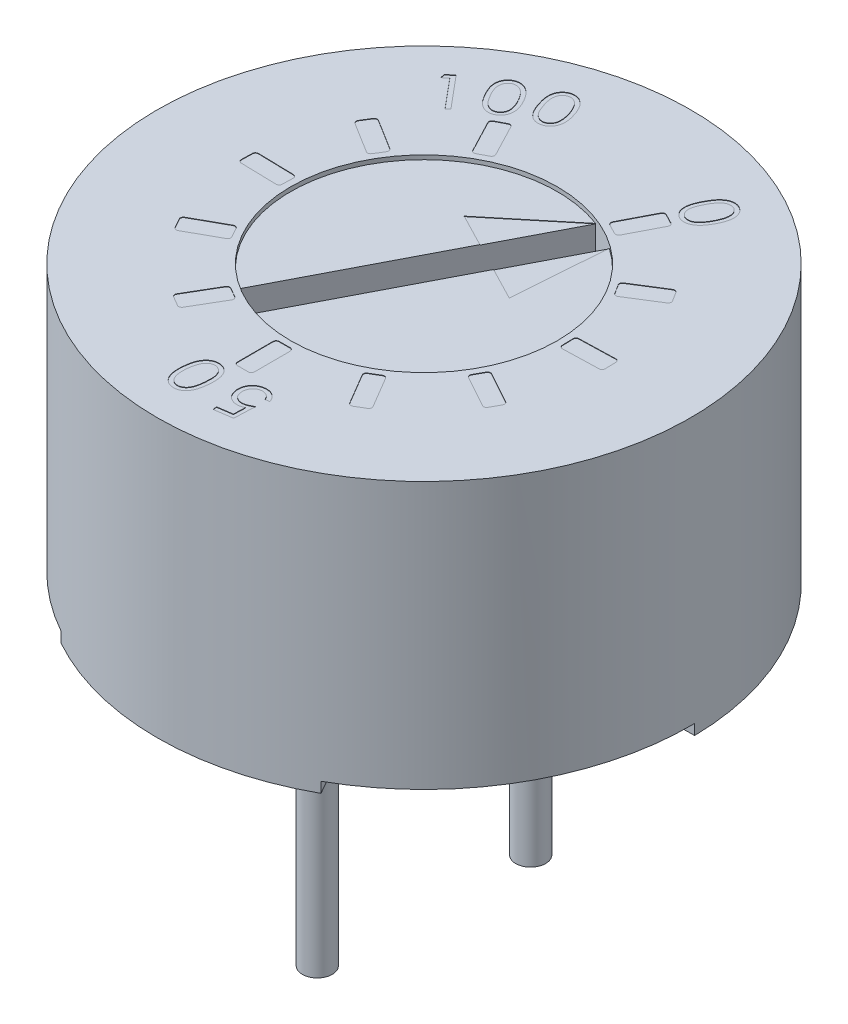
from build123d import *

# Parameters (mm, degrees)
SKETCH1_R                = 6.35
EXTRUDE1_DEPTH           = 6.35
SKETCH2_R                = 3.175
EXTRUDE2_DEPTH           = 0.1
EXTRUDE3_DEPTH           = 0.9
EXTRUDE4_DEPTH           = 0.01
EXTRUDE5_DEPTH           = 0.01
FILLET1_R                = 0.075
CIRPATTERN1_COUNT        = 11
CIRPATTERN1_ANGLE        = 305
FILLET1_OF_CIRPATTERN1_R = 0.075
EXTRUDE6_DEPTH           = 0.01
EXTRUDE7_START           = 0.25
EXTRUDE7_DEPTH           = 0.25
CIRPATTERN2_COUNT        = 3
SKETCH8_R                = 0.3555
EXTRUDE8_DEPTH           = 4.57
SKETCH9_R                = 0.3555
EXTRUDE9_DEPTH           = 2.285


with BuildPart() as part:
    # Sketch1 → Extrude1 (new body)
    with BuildSketch(Plane(origin=(0, 0, 0), x_dir=(1, 0, 0), z_dir=(0, 1, 0))):
        with Locations(Location((0, 0, 0), (0, 0, 270))):
            Circle(SKETCH1_R)
    extrude(amount=EXTRUDE1_DEPTH)

    # Sketch2 → Extrude2 (cut)
    with BuildSketch(Plane(origin=(0, 6.35, 0), x_dir=(-1, 0, 0), z_dir=(0, 1, 0))):
        with Locations(Location((0, 0, 0), (0, 0, 90))):
            Circle(SKETCH2_R)
    extrude(amount=-EXTRUDE2_DEPTH, mode=Mode.SUBTRACT)

    # Sketch3 → Extrude3 (cut)
    with BuildSketch(Plane(origin=(0, 6.25, 0), x_dir=(-1, 0, 0), z_dir=(0, 1, 0))):
        with BuildLine():
            Line((-1.110998183, -2.974274372), (1.787669102, 2.623902472))
            Line((1.787669102, 2.623902472), (-1.787669102, -2.623902472))
            ThreePointArc((-1.787669102, -2.623902472), (-1.459882914, -2.819462161), (-1.110998183, -2.974274372))
        make_face()
        Polygon((1.787669102, 2.623902472), (-1.787669102, -2.623902472), (1.110998183, 2.974274372), align=None)
    extrude(amount=-EXTRUDE3_DEPTH, mode=Mode.SUBTRACT)

    # Sketch4 → Extrude4 (cut)
    with BuildSketch(Plane(origin=(0, 6.25, 0), x_dir=(-1, 0, 0), z_dir=(0, 1, 0))):
        Polygon((-1.110998183, -2.974274372), (0.603770905, -1.560069871), (-1.622475198, -0.407346954), (-1.787669102, -2.623902472), align=None)
    extrude(amount=-EXTRUDE4_DEPTH, mode=Mode.SUBTRACT)

    # Sketch5 → Extrude5 (cut)
    with BuildSketch(Plane(origin=(0, 6.35, 0), x_dir=(-1, 0, 0), z_dir=(0, 1, 0))):
        Polygon((-1.708707163, -2.858570345), (-1.348209149, -3.045231794), (-1.806658783, -3.930632521), (-2.167156797, -3.743971073), align=None)
    extrude5 = extrude(amount=-EXTRUDE5_DEPTH, mode=Mode.SUBTRACT)

    # Fillet1
    fillet1_edges = [part.edges().sort_by_distance(p)[0] for p in [
        (2.167156797, 6.345, -3.743971073),
        (1.708707163, 6.345, -2.858570345),
        (1.348209149, 6.345, -3.045231794),
        (1.806658783, 6.345, -3.930632521),
    ]]
    fillet(fillet1_edges, radius=FILLET1_R)

    # CirPattern1: Extrude5 ×11 about axis
    cirpattern1_axis = Axis((0, 0, 0), (0, -1, 0))
    for i in range(1, CIRPATTERN1_COUNT):
        add(extrude5.rotate(cirpattern1_axis, i * CIRPATTERN1_ANGLE / (CIRPATTERN1_COUNT - 1)), mode=Mode.SUBTRACT)

    # Fillet1 of CirPattern1
    fillet1_of_cirpattern1_edges = [part.edges().sort_by_distance(p)[0] for p in [
        (3.767494441, 6.345, -2.125999439),
        (2.923106032, 6.345, -1.59579313),
        (2.707228277, 6.345, -1.939592649),
        (3.551616686, 6.345, -2.469798958),
        (4.325209347, 6.345, 0.080324849),
        (3.328559629, 6.345, 0.108606555),
        (3.317044506, 6.345, -0.297187378),
        (4.313694223, 6.345, -0.325469085),
        (3.685958556, 6.345, 2.264419904),
        (2.812862046, 6.345, 1.78295028),
        (3.008896268, 6.345, 1.427462027),
        (3.881992778, 6.345, 1.90893165),
        (2.026649405, 6.345, 3.821855592),
        (1.518728296, 6.345, 2.963877351),
        (1.868061025, 6.345, 2.757073194),
        (2.375982134, 6.345, 3.615051435),
        (-0.193518105, 6.345, 4.321624546),
        (-0.195700872, 6.345, 3.324576027),
        (0.210255437, 6.345, 3.323687296),
        (0.212438204, 6.345, 4.320735815),
        (-2.36013109, 6.345, 3.625419867),
        (-1.855971452, 6.345, 2.765225951),
        (-1.505736593, 6.345, 2.970498595),
        (-2.009896231, 6.345, 3.830692511),
        (-3.873597434, 6.345, 1.925910407),
        (-3.002617376, 6.345, 1.440622602),
        (-2.805028551, 6.345, 1.795249124),
        (-3.676008609, 6.345, 2.280536929),
        (-4.31507792, 6.345, -0.306578734),
        (-3.318313926, 6.345, -0.282661065),
        (-3.328052197, 6.345, 0.123179397),
        (-4.324816191, 6.345, 0.099261728),
        (-3.562396497, 6.345, -2.454224761),
        (-2.715694708, 6.345, -1.927720634),
        (-2.93006509, 6.345, -1.582979203),
        (-3.776766879, 6.345, -2.10948333),
        (-1.823851485, 6.345, -3.922684506),
        (-1.361529577, 6.345, -3.039299558),
        (-1.72120685, 6.345, -2.851061481),
        (-2.183528759, 6.345, -3.73444643),
    ]]
    fillet(fillet1_of_cirpattern1_edges, radius=FILLET1_OF_CIRPATTERN1_R)

    # Sketch6 → Extrude6 (cut)
    # profile 1 of 6: a face of its own
    with BuildSketch(Plane(origin=(0, 6.35, 0), x_dir=(-1, 0, 0), z_dir=(0, 1, 0))):
        with BuildLine():
            add(Edge.make_bspline(
                [(-2.041021286, -4.610610271), (-2.048531853, -4.624755576), (-2.06311616, -4.652223472), (-2.086001625, -4.69125374), (-2.108657118, -4.727192412), (-2.131039382, -4.760168413), (-2.153479558, -4.790014029), (-2.175641804, -4.816907029), (-2.197641805, -4.840743116), (-2.219926861, -4.861280257), (-2.242088562, -4.879450124), (-2.264352286, -4.895530271), (-2.286815404, -4.909630335), (-2.309553916, -4.921649597), (-2.332438091, -4.932009201), (-2.355643815, -4.940184801), (-2.37903135, -4.946407854), (-2.402453925, -4.950891388), (-2.425848928, -4.953225285), (-2.449018334, -4.953868168), (-2.471927638, -4.952656985), (-2.494570744, -4.949660305), (-2.516884525, -4.944846403), (-2.538830956, -4.938150873), (-2.560563701, -4.929780401), (-2.574592533, -4.922822508), (-2.58168635, -4.919304181)],
                knots=[0, 0, 0, 0, 1.646223793, 3.196700494, 4.649742713, 6.012941573, 7.292431642, 8.486824456, 9.594156292, 10.623879785, 11.599467776, 12.538661719, 13.445257722, 14.323474714, 15.180732222, 16.025253637, 16.849445287, 17.666632674, 18.473958694, 19.263611761, 20.047215134, 20.829675219, 21.609209308, 22.390946454, 23.186366309, 24, 24, 24, 24], degree=3))
            add(Edge.make_bspline(
                [(-2.58168635, -4.919304181), (-2.588698657, -4.915408805), (-2.60256311, -4.907707023), (-2.622019753, -4.894301888), (-2.640388582, -4.879957881), (-2.657183356, -4.863983072), (-2.672939529, -4.846976876), (-2.687141375, -4.82848917), (-2.699956741, -4.808740477), (-2.711662464, -4.787950538), (-2.72166197, -4.765817723), (-2.730090491, -4.742595521), (-2.736712959, -4.71827246), (-2.741439118, -4.69293817), (-2.744723976, -4.666583463), (-2.745998033, -4.63913782), (-2.745837145, -4.610577879), (-2.743802285, -4.580871354), (-2.739794255, -4.549807126), (-2.733341215, -4.517426145), (-2.724396537, -4.483616682), (-2.713158937, -4.448385973), (-2.699438003, -4.411654951), (-2.68339151, -4.373534508), (-2.665157067, -4.333841783), (-2.651441797, -4.307337174), (-2.64438667, -4.29370322)],
                knots=[0, 0, 0, 0, 0.818221664, 1.617755219, 2.408528098, 3.194352339, 3.980531087, 4.772477655, 5.570121229, 6.381617826, 7.205044658, 8.045773436, 8.900471949, 9.774565544, 10.673929054, 11.608764819, 12.576480326, 13.587359863, 14.645641413, 15.770959321, 16.954448403, 18.213090284, 19.543499224, 20.954674762, 22.433486647, 24, 24, 24, 24], degree=3))
            add(Edge.make_bspline(
                [(-2.64438667, -4.29370322), (-2.637124457, -4.280235866), (-2.622985978, -4.254016874), (-2.60095621, -4.216478699), (-2.578709163, -4.181839203), (-2.55653027, -4.149856158), (-2.534024093, -4.120741021), (-2.511531366, -4.094298686), (-2.488770271, -4.070693893), (-2.465867329, -4.049774907), (-2.442775149, -4.031241871), (-2.419420323, -4.015058885), (-2.396184811, -4.000507155), (-2.37274737, -3.987980142), (-2.348950012, -3.977830401), (-2.325199321, -3.969264113), (-2.301156487, -3.96313217), (-2.277143053, -3.958623983), (-2.253147184, -3.956298298), (-2.229377832, -3.955650177), (-2.205940061, -3.956873389), (-2.182796835, -3.959790761), (-2.160146854, -3.964952482), (-2.137724394, -3.971512559), (-2.115680074, -3.980117646), (-2.101466108, -3.987234067), (-2.094306542, -3.990818604)],
                knots=[0, 0, 0, 0, 1.563066569, 3.04306472, 4.445255294, 5.768070441, 7.017934814, 8.203285405, 9.312900082, 10.365568574, 11.37021548, 12.335361849, 13.266719831, 14.169998601, 15.046927578, 15.907789319, 16.746666351, 17.578915802, 18.401604668, 19.20682736, 20.006017033, 20.79715974, 21.586653741, 22.376619151, 23.182304051, 24, 24, 24, 24], degree=3))
            add(Edge.make_bspline(
                [(-2.094306542, -3.990818604), (-2.087446495, -3.994675057), (-2.07386944, -4.002307551), (-2.054523793, -4.015120822), (-2.036605205, -4.029448122), (-2.0200715, -4.045060049), (-2.004642191, -4.061739076), (-1.990885304, -4.079897626), (-1.978190192, -4.099111424), (-1.966987579, -4.119633891), (-1.957126968, -4.141202932), (-1.949118822, -4.163872166), (-1.942987176, -4.187560426), (-1.938006109, -4.212136724), (-1.935403728, -4.23788995), (-1.934103102, -4.264579002), (-1.934858942, -4.292271187), (-1.936944656, -4.321127664), (-1.941436345, -4.351318054), (-1.948385685, -4.383131205), (-1.95760235, -4.416701738), (-1.969350861, -4.452115777), (-1.98351963, -4.489309402), (-2.000624185, -4.528154188), (-2.019425161, -4.56908205), (-2.033690198, -4.596512972), (-2.041021286, -4.610610271)],
                knots=[0, 0, 0, 0, 0.80975725, 1.602630119, 2.385010428, 3.167722644, 3.94108762, 4.720413811, 5.509495508, 6.309129477, 7.124118522, 7.947868044, 8.779633185, 9.640826942, 10.525686133, 11.440589076, 12.389146411, 13.374742675, 14.416567519, 15.527195189, 16.724182898, 17.997633339, 19.365778855, 20.818548637, 22.364988512, 24, 24, 24, 24], degree=3))
        make_face()
        with BuildLine():
            add(Edge.make_bspline(
                [(-2.123553337, -4.564937194), (-2.117286631, -4.552813491), (-2.105136617, -4.529307815), (-2.088424447, -4.494701656), (-2.074134035, -4.461784593), (-2.06124576, -4.430941485), (-2.050927746, -4.401733677), (-2.042427765, -4.374487635), (-2.035895032, -4.349101458), (-2.03139254, -4.325340978), (-2.028893185, -4.302766236), (-2.027281062, -4.281173433), (-2.027651059, -4.260228358), (-2.028844687, -4.2400545), (-2.031948814, -4.220639917), (-2.036379206, -4.202052612), (-2.041914985, -4.184018898), (-2.051504456, -4.161509841), (-2.0656894, -4.135578976), (-2.086635675, -4.108424876), (-2.110920005, -4.08564519), (-2.129795725, -4.074622839), (-2.139178337, -4.069143925)],
                knots=[0, 0, 0, 0, 1.476864034, 2.863373306, 4.157598534, 5.359904342, 6.479804183, 7.508323379, 8.447691968, 9.315042264, 10.122600593, 10.904636606, 11.656166216, 12.38773407, 13.089838447, 13.780395253, 14.454577122, 15.128255394, 16.425261349, 17.640804981, 18.827307688, 20, 20, 20, 20], degree=3))
            add(Edge.make_bspline(
                [(-2.139178337, -4.069143925), (-2.149122795, -4.064487819), (-2.168965944, -4.055197037), (-2.20138924, -4.048076524), (-2.23517109, -4.045724566), (-2.264081979, -4.048740277), (-2.28755093, -4.053663221), (-2.305243312, -4.059116747), (-2.322768458, -4.066212325), (-2.340190488, -4.074826702), (-2.357550656, -4.085118303), (-2.37463558, -4.097186603), (-2.391796648, -4.110575198), (-2.402666234, -4.120548689), (-2.408208786, -4.125634309)],
                knots=[0, 0, 0, 0, 1.339707884, 2.67325019, 4.032244688, 5.468513708, 6.211919267, 6.963848198, 7.729888153, 8.522640497, 9.339397821, 10.195992865, 11.080112023, 12, 12, 12, 12], degree=3))
            add(Edge.make_bspline(
                [(-2.408208786, -4.125634309), (-2.415086685, -4.132312362), (-2.429052247, -4.145872136), (-2.449102524, -4.167815229), (-2.468666444, -4.19147895), (-2.488034937, -4.21678888), (-2.506720234, -4.244034937), (-2.52521413, -4.272930727), (-2.543218117, -4.303556227), (-2.554644606, -4.324781822), (-2.560452376, -4.335570207)],
                knots=[0, 0, 0, 0, 0.883043492, 1.793018297, 2.736619076, 3.711077747, 4.728102424, 5.779306923, 6.871282927, 8, 8, 8, 8], degree=3))
            add(Edge.make_bspline(
                [(-2.560452376, -4.335570207), (-2.566058327, -4.346489454), (-2.577026056, -4.367852347), (-2.592004549, -4.3996451), (-2.605387637, -4.430385306), (-2.616696857, -4.460193006), (-2.626642473, -4.48895065), (-2.634854581, -4.51667578), (-2.641354722, -4.543406218), (-2.64596488, -4.569103944), (-2.648960094, -4.593723578), (-2.650589546, -4.617258451), (-2.650921494, -4.639748741), (-2.649384141, -4.661214079), (-2.646961792, -4.681674441), (-2.642737113, -4.701061821), (-2.636846682, -4.719295944), (-2.627688278, -4.741944743), (-2.613441929, -4.76762399), (-2.592570146, -4.794366758), (-2.568620721, -4.817120374), (-2.549942343, -4.828091642), (-2.540620645, -4.833567002)],
                knots=[0, 0, 0, 0, 1.328682253, 2.599492104, 3.803995452, 4.957191288, 6.049894639, 7.09748019, 8.086331245, 9.026421384, 9.922136576, 10.769867243, 11.579511995, 12.354634462, 13.097924459, 13.808287387, 14.49869283, 15.169871266, 16.451225399, 17.661527984, 18.832953831, 20, 20, 20, 20], degree=3))
            add(Edge.make_bspline(
                [(-2.540620645, -4.833567002), (-2.530681532, -4.838242489), (-2.510803491, -4.847593377), (-2.478117203, -4.85444344), (-2.444088294, -4.856532213), (-2.414922094, -4.853558891), (-2.391244581, -4.848655862), (-2.373312016, -4.843141276), (-2.355512606, -4.83621336), (-2.338022991, -4.827399056), (-2.320536693, -4.817450118), (-2.303294048, -4.805756201), (-2.286251167, -4.792487211), (-2.269207529, -4.777487501), (-2.2521011, -4.760278302), (-2.234540286, -4.740616716), (-2.217125893, -4.717794654), (-2.19883328, -4.692673024), (-2.180441614, -4.664661087), (-2.161586684, -4.634046056), (-2.14261665, -4.600462373), (-2.130051931, -4.577047561), (-2.123553337, -4.564937194)],
                knots=[0, 0, 0, 0, 1.184760376, 2.369498728, 3.58528124, 4.862625074, 5.5271166, 6.198988772, 6.889855373, 7.590919818, 8.315809253, 9.065159293, 9.842571992, 10.651274505, 11.519659924, 12.466336616, 13.500985966, 14.623780008, 15.827938908, 17.125147421, 18.513098482, 20, 20, 20, 20], degree=3))
        make_face(mode=Mode.SUBTRACT)
    # profile 2 of 6: a face of its own
    with BuildSketch(Plane(origin=(0, 6.35, 0), x_dir=(-1, 0, 0), z_dir=(0, 1, 0))):
        with BuildLine():
            add(Edge.make_bspline(
                [(0.074806635, 5.041278571), (0.076253019, 5.05717987), (0.079064937, 5.088093629), (0.084633258, 5.132937176), (0.091372288, 5.174918), (0.09948382, 5.21396143), (0.108101521, 5.250269229), (0.118077088, 5.283601117), (0.129317614, 5.313950167), (0.14155094, 5.341594669), (0.154963016, 5.366866043), (0.169165629, 5.390375032), (0.1843709, 5.412176974), (0.200401058, 5.432341191), (0.217467472, 5.450642734), (0.235593491, 5.467145218), (0.254654645, 5.481949447), (0.274471561, 5.495261932), (0.295101154, 5.50659638), (0.31622183, 5.516353106), (0.337867446, 5.524013051), (0.359807118, 5.530480037), (0.382256623, 5.534467097), (0.405056189, 5.537267404), (0.428321432, 5.537770959), (0.443934426, 5.536906782), (0.45180984, 5.536470879)],
                knots=[0, 0, 0, 0, 1.642272928, 3.19274716, 4.647094419, 6.014302073, 7.293671023, 8.484406887, 9.590545911, 10.620563334, 11.591427458, 12.531407715, 13.444066213, 14.323638965, 15.178902062, 16.01514516, 16.842227636, 17.659440999, 18.467978414, 19.26093357, 20.049593744, 20.827928056, 21.610583878, 22.391821981, 23.188812256, 24, 24, 24, 24], degree=3))
            add(Edge.make_bspline(
                [(0.45180984, 5.536470879), (0.459776416, 5.535676761), (0.475540474, 5.534105381), (0.498671768, 5.529300776), (0.521162664, 5.523214343), (0.542830451, 5.515118638), (0.563769121, 5.505439488), (0.584104069, 5.494198683), (0.603753383, 5.481165879), (0.622558566, 5.46633695), (0.640409469, 5.449837267), (0.657303149, 5.431880737), (0.672708275, 5.412031504), (0.687236981, 5.390772349), (0.70046777, 5.367649529), (0.712325386, 5.342779768), (0.723522642, 5.31648097), (0.733110975, 5.288285926), (0.741299997, 5.258109441), (0.74817994, 5.225834471), (0.753054419, 5.191288965), (0.756448315, 5.154520923), (0.758195109, 5.115416632), (0.758339236, 5.074054071), (0.756958285, 5.030419842), (0.754801258, 5.000674185), (0.753692853, 4.985389148)],
                knots=[0, 0, 0, 0, 0.81707043, 1.616798156, 2.409253754, 3.194606741, 3.97568502, 4.763196184, 5.565101387, 6.380890316, 7.20611523, 8.045613763, 8.895489273, 9.769293657, 10.673462277, 11.61281777, 12.581659369, 13.590887526, 14.651275446, 15.773366024, 16.958577418, 18.211847317, 19.542989128, 20.954561198, 22.435077587, 24, 24, 24, 24], degree=3))
            add(Edge.make_bspline(
                [(0.753692853, 4.985389148), (0.752352479, 4.970217417), (0.749737065, 4.940613478), (0.743762953, 4.897553333), (0.737078222, 4.856901215), (0.729183918, 4.818750765), (0.719631371, 4.783257182), (0.70940022, 4.750048531), (0.697522724, 4.71947348), (0.684755316, 4.691164552), (0.670480495, 4.665272037), (0.655853493, 4.640945776), (0.639854534, 4.61861904), (0.623156597, 4.597988176), (0.605355309, 4.579228939), (0.586754734, 4.562128645), (0.567088185, 4.546899089), (0.546629753, 4.533496482), (0.525606368, 4.52174807), (0.503898899, 4.512288429), (0.481958249, 4.504101612), (0.459582029, 4.497879196), (0.436702908, 4.493749458), (0.413555799, 4.49102985), (0.389896114, 4.490494934), (0.374081958, 4.49136085), (0.366072661, 4.491799404)],
                knots=[0, 0, 0, 0, 1.556680886, 3.037483888, 4.44238982, 5.767690181, 7.017696536, 8.198532969, 9.317813738, 10.368519616, 11.370309337, 12.338420547, 13.268362895, 14.175557506, 15.049479884, 15.90945687, 16.755946825, 17.588927135, 18.407691527, 19.214389107, 20.006899006, 20.800114037, 21.584617834, 22.381349166, 23.180212009, 24, 24, 24, 24], degree=3))
            add(Edge.make_bspline(
                [(0.366072661, 4.491799404), (0.358245114, 4.492622049), (0.342705022, 4.494255252), (0.319838037, 4.498660856), (0.297761534, 4.504923905), (0.276448081, 4.512727834), (0.255925315, 4.522246479), (0.235999715, 4.533199996), (0.216968652, 4.546182849), (0.198528364, 4.560520106), (0.181070801, 4.576564354), (0.164816696, 4.594272633), (0.149676323, 4.613588094), (0.136039358, 4.634621514), (0.123199228, 4.657004226), (0.111932423, 4.68114334), (0.101395117, 4.706738131), (0.092467186, 4.734223595), (0.084381141, 4.763686899), (0.07867704, 4.795761869), (0.073964428, 4.830302982), (0.071137523, 4.867490979), (0.069418669, 4.907247489), (0.06985741, 4.949678911), (0.071321145, 4.994646997), (0.073624235, 5.025459512), (0.074806635, 5.041278571)],
                knots=[0, 0, 0, 0, 0.810058639, 1.608215887, 2.393870619, 3.170328306, 3.942391259, 4.720945964, 5.50840321, 6.311518738, 7.124023985, 7.946242869, 8.78372413, 9.647457234, 10.524870221, 11.438149422, 12.387930972, 13.372719036, 14.41159343, 15.530687135, 16.723632428, 17.999595569, 19.368733634, 20.819277439, 22.367025888, 24, 24, 24, 24], degree=3))
        make_face()
        with BuildLine():
            add(Edge.make_bspline(
                [(0.168756956, 5.031462866), (0.167763766, 5.017844824), (0.165836978, 4.991425836), (0.163996956, 4.953022557), (0.163331317, 4.917146167), (0.16396735, 4.883809438), (0.165456164, 4.852926633), (0.168212696, 4.824506435), (0.172148773, 4.798537775), (0.177404973, 4.774941313), (0.183673322, 4.753119643), (0.191097995, 4.732830234), (0.199274621, 4.713639363), (0.208594034, 4.695748464), (0.218653752, 4.678839559), (0.23021874, 4.663470949), (0.242422294, 4.649104641), (0.259854834, 4.6320314), (0.2830943, 4.613762981), (0.313074127, 4.597185402), (0.344345582, 4.585536081), (0.366048005, 4.582739682), (0.376889969, 4.581342674)],
                knots=[0, 0, 0, 0, 1.477610655, 2.866563107, 4.160233266, 5.359977142, 6.474311365, 7.50540577, 8.448721511, 9.314810183, 10.119809356, 10.903876248, 11.651568986, 12.375523875, 13.085642101, 13.777924946, 14.454336735, 15.123725616, 16.416002462, 17.638660614, 18.820336478, 20, 20, 20, 20], degree=3))
            add(Edge.make_bspline(
                [(0.376889969, 4.581342674), (0.387791846, 4.580950833), (0.409623467, 4.580166149), (0.442217863, 4.586090859), (0.47392721, 4.597682202), (0.499415962, 4.611332085), (0.518955337, 4.625103785), (0.533269702, 4.636911122), (0.54665696, 4.650405298), (0.55924916, 4.665254074), (0.571177207, 4.681441149), (0.582402948, 4.699081548), (0.592762638, 4.71826648), (0.598921511, 4.731746441), (0.602050225, 4.738594276)],
                knots=[0, 0, 0, 0, 1.332950808, 2.669308781, 4.024721813, 5.455336601, 6.194947274, 6.949860932, 7.724708579, 8.519453021, 9.332334011, 10.18531817, 11.078139682, 12, 12, 12, 12], degree=3))
            add(Edge.make_bspline(
                [(0.602050225, 4.738594276), (0.605836058, 4.747363884), (0.613548763, 4.765229803), (0.623170212, 4.793351625), (0.632022963, 4.822813299), (0.639788524, 4.853703436), (0.646653835, 4.885958948), (0.652177689, 4.919731654), (0.656824541, 4.954937645), (0.659024006, 4.978969936), (0.660143174, 4.991198443)],
                knots=[0, 0, 0, 0, 0.880080856, 1.792948359, 2.737304663, 3.715004179, 4.727718167, 5.775921243, 6.868307628, 8, 8, 8, 8], degree=3))
            add(Edge.make_bspline(
                [(0.660143174, 4.991198443), (0.661115224, 5.00341207), (0.663015038, 5.027282881), (0.66405292, 5.062371152), (0.664374191, 5.095905408), (0.663397119, 5.127784012), (0.661204195, 5.158061356), (0.657837952, 5.186677663), (0.653270394, 5.213767553), (0.647453657, 5.239233018), (0.640625209, 5.263081608), (0.633035226, 5.28545199), (0.624484502, 5.30630366), (0.614824174, 5.325534582), (0.604469779, 5.343315813), (0.59292531, 5.35934769), (0.58078562, 5.374125295), (0.56328394, 5.391150882), (0.540232097, 5.409243548), (0.510622949, 5.425697766), (0.479717386, 5.43707713), (0.458307183, 5.439904891), (0.44760311, 5.441318635)],
                knots=[0, 0, 0, 0, 1.327787497, 2.595082083, 3.803754689, 4.962308897, 6.050838694, 7.093078982, 8.084210708, 9.027023232, 9.922741183, 10.771867947, 11.586360315, 12.363162899, 13.102940204, 13.813868132, 14.502375689, 15.172805586, 16.456934668, 17.665325549, 18.832774954, 20, 20, 20, 20], degree=3))
            add(Edge.make_bspline(
                [(0.44760311, 5.441318635), (0.436633538, 5.441715956), (0.414733414, 5.442509185), (0.381874679, 5.436509813), (0.34976645, 5.424846094), (0.323926992, 5.410800263), (0.304194615, 5.396748356), (0.289619858, 5.384962119), (0.276093227, 5.371533504), (0.263345829, 5.356649914), (0.25119201, 5.34059765), (0.23992626, 5.323024586), (0.229556542, 5.304090218), (0.219587798, 5.283721559), (0.210453476, 5.261198723), (0.202464941, 5.236155243), (0.194656873, 5.208628407), (0.18834509, 5.178238711), (0.181958039, 5.145372067), (0.176949393, 5.109709205), (0.172237359, 5.071523117), (0.169941179, 5.045093556), (0.168756956, 5.031462866)],
                knots=[0, 0, 0, 0, 1.185206334, 2.366196842, 3.586874517, 4.87075765, 5.534450156, 6.207170249, 6.89706176, 7.593920717, 8.326726547, 9.074454216, 9.850796106, 10.662074394, 11.527670968, 12.478381852, 13.505843225, 14.62285613, 15.836152336, 17.129034761, 18.519338396, 20, 20, 20, 20], degree=3))
        make_face(mode=Mode.SUBTRACT)
    # profile 3 of 6: a face of its own
    with BuildSketch(Plane(origin=(0, 6.35, 0), x_dir=(-1, 0, 0), z_dir=(0, 1, 0))):
        with BuildLine():
            Line((-0.49330418, 5.513245166), (-0.479882706, 5.419495166))
            Line((-0.479882706, 5.419495166), (-0.830844244, 5.369014397))
            Line((-0.830844244, 5.369014397), (-0.84086027, 5.093373371))
            add(Edge.make_bspline(
                [(-0.84086027, 5.093373371), (-0.830893577, 5.097703044), (-0.811510646, 5.106123265), (-0.782623499, 5.116299425), (-0.754909263, 5.123955185), (-0.73672349, 5.127100279), (-0.727879501, 5.128629781)],
                knots=[0, 0, 0, 0, 1.098060995, 2.135476651, 3.093256877, 4, 4, 4, 4], degree=3))
            add(Edge.make_bspline(
                [(-0.727879501, 5.128629781), (-0.716811521, 5.130001187), (-0.695130908, 5.132687578), (-0.662854407, 5.13263851), (-0.631695405, 5.130272426), (-0.601629593, 5.124335579), (-0.572625403, 5.115497056), (-0.544672409, 5.103647905), (-0.517860701, 5.088667697), (-0.492403551, 5.070909791), (-0.468534384, 5.050771719), (-0.447121151, 5.028283703), (-0.428099191, 5.003913382), (-0.411838663, 4.977454926), (-0.397969664, 4.949070392), (-0.386585806, 4.918758694), (-0.377588883, 4.886459147), (-0.373964382, 4.864050997), (-0.37211027, 4.852588114)],
                knots=[0, 0, 0, 0, 1.059390516, 2.075196892, 3.062695081, 4.026396627, 4.982329477, 5.940999043, 6.907269323, 7.897030198, 8.887950986, 9.871338629, 10.844094296, 11.821912505, 12.818511503, 13.843186958, 14.896682971, 16, 16, 16, 16], degree=3))
            add(Edge.make_bspline(
                [(-0.37211027, 4.852588114), (-0.371060211, 4.844586325), (-0.368974546, 4.828692874), (-0.367897681, 4.804788961), (-0.3680721, 4.78118302), (-0.369603772, 4.757882554), (-0.37289134, 4.734946409), (-0.377515498, 4.712274998), (-0.383439272, 4.689807825), (-0.391155204, 4.667870914), (-0.399807182, 4.646522078), (-0.409908185, 4.626202588), (-0.421117961, 4.60690361), (-0.433604593, 4.588709716), (-0.447005954, 4.571287461), (-0.46191513, 4.555185403), (-0.477683919, 4.5398193), (-0.494840307, 4.525879473), (-0.512771266, 4.512766515), (-0.531929316, 4.501164532), (-0.551957113, 4.490769983), (-0.572884388, 4.4815013), (-0.594769838, 4.473482418), (-0.61759945, 4.466743658), (-0.641305124, 4.460979203), (-0.657544731, 4.458442057), (-0.665780142, 4.457155422)],
                knots=[0, 0, 0, 0, 1.052462394, 2.09043992, 3.118426065, 4.131352733, 5.134189789, 6.138765847, 7.14884152, 8.162666836, 9.170523675, 10.152291099, 11.12047599, 12.079723174, 13.029429328, 13.985189194, 14.940154712, 15.899401896, 16.866528039, 17.836161928, 18.818045293, 19.808700456, 20.820165117, 21.856496307, 22.912988933, 24, 24, 24, 24], degree=3))
            add(Edge.make_bspline(
                [(-0.665780142, 4.457155422), (-0.675649176, 4.455986685), (-0.695007318, 4.453694204), (-0.723835673, 4.453157424), (-0.751780836, 4.454930352), (-0.778974326, 4.459073834), (-0.805308088, 4.465977044), (-0.830811408, 4.475180514), (-0.85545668, 4.486881712), (-0.878925706, 4.501085717), (-0.901088291, 4.5172653), (-0.921683318, 4.53514771), (-0.940262258, 4.554791438), (-0.957069009, 4.576009351), (-0.971914565, 4.598869533), (-0.984705092, 4.623473252), (-0.995851349, 4.649573683), (-1.001603047, 4.667837934), (-1.004522129, 4.677107345)],
                knots=[0, 0, 0, 0, 1.075548572, 2.109691868, 3.116791376, 4.104604437, 5.083139307, 6.059749083, 7.036439148, 8.032132384, 9.025644415, 10.00439295, 10.981216813, 11.948927236, 12.931593606, 13.927680527, 14.948263454, 16, 16, 16, 16], degree=3))
            Line((-1.004522129, 4.677107345), (-0.90356059, 4.691730743))
            add(Edge.make_bspline(
                [(-0.90356059, 4.691730743), (-0.900223172, 4.682893023), (-0.893811391, 4.665914171), (-0.881264578, 4.642721549), (-0.867900007, 4.622023774), (-0.852176221, 4.604511975), (-0.834576882, 4.589814081), (-0.815482953, 4.576711229), (-0.793976946, 4.566266583), (-0.771048856, 4.557434142), (-0.746908134, 4.551271993), (-0.722324621, 4.547861158), (-0.697566937, 4.547111459), (-0.68119349, 4.54897189), (-0.67299168, 4.54990382)],
                knots=[0, 0, 0, 0, 1.150418798, 2.210161754, 3.208131856, 4.147856348, 5.066180133, 5.998683492, 6.963462419, 7.973446351, 8.990296775, 9.993069854, 10.994685703, 12, 12, 12, 12], degree=3))
            add(Edge.make_bspline(
                [(-0.67299168, 4.54990382), (-0.665073876, 4.551271461), (-0.649384241, 4.553981531), (-0.626808374, 4.560932254), (-0.605265705, 4.569666419), (-0.585235611, 4.581141184), (-0.565982355, 4.594224365), (-0.548432309, 4.610158667), (-0.531642692, 4.627716209), (-0.516594875, 4.647581596), (-0.503067637, 4.66869157), (-0.491759198, 4.690976194), (-0.482582054, 4.714050716), (-0.476326216, 4.738174407), (-0.472079622, 4.762968055), (-0.469995533, 4.788580786), (-0.470676917, 4.815076992), (-0.47279539, 4.832902842), (-0.47387309, 4.841971127)],
                knots=[0, 0, 0, 0, 0.978659814, 1.939277008, 2.873560371, 3.806566129, 4.748232453, 5.705498025, 6.690233175, 7.706235412, 8.738286572, 9.743106492, 10.748387959, 11.759388208, 12.775162133, 13.812209598, 14.887037221, 16, 16, 16, 16], degree=3))
            add(Edge.make_bspline(
                [(-0.47387309, 4.841971127), (-0.475165499, 4.850089572), (-0.477692098, 4.865960745), (-0.484406113, 4.888715565), (-0.492177587, 4.910261403), (-0.50232023, 4.930116375), (-0.514070407, 4.948549268), (-0.527430766, 4.965722556), (-0.543039765, 4.981077539), (-0.559982701, 4.995152074), (-0.578417273, 5.007306801), (-0.597941122, 5.017680594), (-0.618669833, 5.025662819), (-0.640424893, 5.031514543), (-0.663196237, 5.035034929), (-0.686921221, 5.03667098), (-0.711726462, 5.036028227), (-0.728491979, 5.034077699), (-0.737094244, 5.033076897)],
                knots=[0, 0, 0, 0, 1.076207365, 2.103934057, 3.103558538, 4.074109796, 5.018427245, 5.965538239, 6.918452861, 7.882035888, 8.848000096, 9.807002667, 10.773917706, 11.752483692, 12.753792074, 13.788758067, 14.865427835, 16, 16, 16, 16], degree=3))
            add(Edge.make_bspline(
                [(-0.737094244, 5.033076897), (-0.744531777, 5.031863792), (-0.759870363, 5.029361979), (-0.783004523, 5.023100093), (-0.80711565, 5.015553109), (-0.83210883, 5.006004692), (-0.858034343, 4.994613527), (-0.884821517, 4.981297845), (-0.912649108, 4.96650707), (-0.93111952, 4.955437343), (-0.940619885, 4.949743563)],
                knots=[0, 0, 0, 0, 0.81667908, 1.684255079, 2.595684873, 3.555885512, 4.583706668, 5.665290172, 6.799128248, 8, 8, 8, 8], degree=3))
            Line((-0.940619885, 4.949743563), (-0.919986872, 5.451746768))
            Line((-0.919986872, 5.451746768), (-0.49330418, 5.513245166))
        make_face()
    # profile 4 of 6: a face of its own
    with BuildSketch(Plane(origin=(0, 6.35, 0), x_dir=(-1, 0, 0), z_dir=(0, 1, 0))):
        with BuildLine():
            add(Edge.make_bspline(
                [(1.927678539, -4.655017487), (1.932650634, -4.670077388), (1.94230725, -4.699326157), (1.954775691, -4.742480366), (1.964928535, -4.783470687), (1.973287156, -4.822184841), (1.979371708, -4.858680066), (1.983169877, -4.892989586), (1.985142779, -4.925089417), (1.98471621, -4.955211077), (1.982421605, -4.983550391), (1.978963968, -5.010624302), (1.973474382, -5.036353355), (1.966705458, -5.061019327), (1.958236062, -5.084411808), (1.948515883, -5.106836608), (1.936782629, -5.12783362), (1.923804687, -5.147658578), (1.909548935, -5.166154363), (1.894075963, -5.183232713), (1.877491498, -5.198882521), (1.859674277, -5.212899941), (1.841090325, -5.225873686), (1.821196266, -5.237041083), (1.800195103, -5.246739519), (1.785624959, -5.252073393), (1.778239436, -5.254777103)],
                knots=[0, 0, 0, 0, 1.642224129, 3.189465558, 4.650187684, 6.014506374, 7.289964814, 8.479655754, 9.58775738, 10.618141165, 11.596076951, 12.530969552, 13.44229508, 14.318036335, 15.177603919, 16.016594401, 16.84604196, 17.664960199, 18.468525031, 19.26157864, 20.049157111, 20.826684812, 21.607311773, 22.393796722, 23.185824739, 24, 24, 24, 24], degree=3))
            add(Edge.make_bspline(
                [(1.778239436, -5.254777103), (1.770665224, -5.257191481), (1.755673633, -5.261970244), (1.732688246, -5.26656415), (1.70983314, -5.26999422), (1.686838325, -5.271009545), (1.663861232, -5.270788436), (1.640827651, -5.268242928), (1.617857599, -5.264067255), (1.594914852, -5.258077605), (1.57231777, -5.249989994), (1.549871571, -5.240173438), (1.527973264, -5.22811345), (1.506399688, -5.214218666), (1.485328053, -5.198329549), (1.464750683, -5.180427076), (1.44436093, -5.160747181), (1.424588086, -5.138790659), (1.404919423, -5.11476033), (1.386459736, -5.087688242), (1.368119393, -5.058233268), (1.350608575, -5.025927941), (1.33353114, -4.990989062), (1.317212027, -4.953313745), (1.301293653, -4.912986477), (1.291620798, -4.884957707), (1.286652898, -4.870562359)],
                knots=[0, 0, 0, 0, 0.81689972, 1.616884571, 2.407382162, 3.191290661, 3.981101966, 4.768252003, 5.57100243, 6.380479853, 7.203618722, 8.036807178, 8.897225527, 9.77150714, 10.673817005, 11.608571467, 12.574949971, 13.586085818, 14.645657675, 15.765718143, 16.952915155, 18.212853074, 19.54263756, 20.951069191, 22.434094011, 24, 24, 24, 24], degree=3))
            add(Edge.make_bspline(
                [(1.286652898, -4.870562359), (1.281956128, -4.856167408), (1.272800978, -4.828108137), (1.26089667, -4.786584392), (1.251334786, -4.746791696), (1.243651553, -4.708848918), (1.237912605, -4.672773261), (1.234538376, -4.638456859), (1.232978778, -4.605951563), (1.233812278, -4.575164104), (1.236527149, -4.545962264), (1.24035701, -4.518015864), (1.246246562, -4.491415975), (1.253478233, -4.466066105), (1.261994609, -4.441863256), (1.272480379, -4.419094605), (1.284321661, -4.397486845), (1.297734827, -4.377256174), (1.312610645, -4.358487619), (1.328388805, -4.34099922), (1.345337039, -4.325050437), (1.363410888, -4.310662922), (1.382464499, -4.297509546), (1.402751695, -4.286140241), (1.424061847, -4.276242961), (1.438853006, -4.270894445), (1.446308347, -4.268198577)],
                knots=[0, 0, 0, 0, 1.558308137, 3.037522522, 4.444324253, 5.76917526, 7.021059981, 8.202010483, 9.316356441, 10.368172438, 11.368647888, 12.333730383, 13.26921722, 14.169772572, 15.045791099, 15.906883581, 16.746594645, 17.579529181, 18.401677428, 19.209278359, 20.001737366, 20.793808899, 21.584866141, 22.381871266, 23.184397784, 24, 24, 24, 24], degree=3))
            add(Edge.make_bspline(
                [(1.446308347, -4.268198577), (1.4537584, -4.265894747), (1.468592914, -4.26130737), (1.491142703, -4.256263321), (1.513741999, -4.253361645), (1.536230773, -4.251801173), (1.558753149, -4.252477737), (1.581228963, -4.254958824), (1.603782092, -4.258856646), (1.626179771, -4.264983335), (1.648435224, -4.272666797), (1.670120655, -4.282651156), (1.691471064, -4.294264556), (1.712254168, -4.307929457), (1.732605967, -4.323454171), (1.752464545, -4.340945092), (1.771836837, -4.360435884), (1.791023695, -4.381788777), (1.809903366, -4.405551215), (1.82770595, -4.432584631), (1.845621638, -4.462248186), (1.863039987, -4.494930832), (1.879735537, -4.530748776), (1.896445872, -4.569347207), (1.912374721, -4.61113369), (1.922476668, -4.640101088), (1.927678539, -4.655017487)],
                knots=[0, 0, 0, 0, 0.808207158, 1.609298655, 2.391476334, 3.168244783, 3.943778599, 4.723471464, 5.510990802, 6.31357615, 7.127954833, 7.948867285, 8.78524683, 9.645350148, 10.524462048, 11.43673938, 12.386280348, 13.371555235, 14.411527161, 15.528855587, 16.724266458, 18.003194212, 19.365600951, 20.819831622, 22.362412071, 24, 24, 24, 24], degree=3))
        make_face()
        with BuildLine():
            add(Edge.make_bspline(
                [(1.83833559, -4.682862039), (1.833918058, -4.670088343), (1.825349657, -4.645312034), (1.811962216, -4.609600929), (1.79837798, -4.576606937), (1.784773158, -4.546331871), (1.771244652, -4.518772554), (1.757348467, -4.494105983), (1.743605269, -4.471931905), (1.729500094, -4.452356862), (1.715105638, -4.435021042), (1.700630068, -4.419200594), (1.685562879, -4.404949818), (1.670075388, -4.392171061), (1.654047915, -4.381006073), (1.637609126, -4.371422771), (1.620789392, -4.363110562), (1.598075626, -4.354511304), (1.569782617, -4.346973845), (1.535994783, -4.343423186), (1.503035272, -4.345375366), (1.482159752, -4.351220892), (1.471749052, -4.354136077)],
                knots=[0, 0, 0, 0, 1.473474595, 2.858003206, 4.157148041, 5.362691826, 6.476095451, 7.502756445, 8.448016563, 9.318808326, 10.130642797, 10.903382256, 11.655196345, 12.389682408, 13.090420649, 13.782101011, 14.462542582, 15.133099417, 16.427340104, 17.642079962, 18.824096515, 20, 20, 20, 20], degree=3))
            add(Edge.make_bspline(
                [(1.471749052, -4.354136077), (1.461613513, -4.3580361), (1.441371577, -4.365824931), (1.414147319, -4.384350959), (1.389335489, -4.407000309), (1.371507383, -4.42972811), (1.359151663, -4.450009192), (1.350807885, -4.466378926), (1.343917504, -4.483784418), (1.337961866, -4.502143903), (1.333673161, -4.521616428), (1.330489757, -4.542087944), (1.328391694, -4.56356116), (1.328211314, -4.578222943), (1.328119244, -4.58570659)],
                knots=[0, 0, 0, 0, 1.336122868, 2.668404137, 4.032956998, 5.470317402, 6.213596871, 6.961610651, 7.734267262, 8.521201294, 9.340717033, 10.191408146, 11.076861087, 12, 12, 12, 12], degree=3))
            add(Edge.make_bspline(
                [(1.328119244, -4.58570659), (1.328161847, -4.595190812), (1.328248632, -4.614510615), (1.330111992, -4.643999457), (1.333531092, -4.67441413), (1.338550271, -4.705698566), (1.345283208, -4.737802573), (1.353220936, -4.770845623), (1.362917343, -4.804750228), (1.370254434, -4.827514016), (1.373992642, -4.839112039)],
                knots=[0, 0, 0, 0, 0.879654305, 1.791896995, 2.739275609, 3.717890018, 4.729811387, 5.781446974, 6.869659591, 8, 8, 8, 8], degree=3))
            add(Edge.make_bspline(
                [(1.373992642, -4.839112039), (1.378021694, -4.850612641), (1.385900897, -4.873103189), (1.398170687, -4.905750366), (1.411253058, -4.936339539), (1.42493138, -4.964915806), (1.438651144, -4.991801023), (1.452843874, -5.016740564), (1.467677201, -5.039578608), (1.482937316, -5.060501585), (1.498553441, -5.079536158), (1.51444359, -5.096816669), (1.530407666, -5.112498124), (1.546665581, -5.126363014), (1.563139527, -5.138522092), (1.579947475, -5.148685506), (1.596947643, -5.157236123), (1.619515095, -5.166154977), (1.647797865, -5.173325356), (1.681323732, -5.176894098), (1.714052544, -5.17527598), (1.734711917, -5.169371948), (1.744986231, -5.166435757)],
                knots=[0, 0, 0, 0, 1.329023195, 2.599034166, 3.802932218, 4.956069443, 6.053692776, 7.094268778, 8.084039953, 9.022092595, 9.91724236, 10.767669794, 11.581351818, 12.356240677, 13.096189766, 13.811836934, 14.49576769, 15.169227507, 16.455091404, 17.663057397, 18.837792193, 20, 20, 20, 20], degree=3))
            add(Edge.make_bspline(
                [(1.744986231, -5.166435757), (1.755173944, -5.162447111), (1.775490492, -5.154492869), (1.803115117, -5.136120801), (1.827724186, -5.11287585), (1.84580866, -5.090038858), (1.858430429, -5.069520729), (1.866874114, -5.052928346), (1.873819484, -5.035296761), (1.879958374, -5.016894499), (1.884445333, -4.997358819), (1.887934169, -4.976966801), (1.889754879, -4.955597132), (1.890947662, -4.933139912), (1.890206468, -4.90904625), (1.887946776, -4.883043294), (1.884155724, -4.854803027), (1.878231798, -4.824567073), (1.870715724, -4.792124055), (1.861762617, -4.757551603), (1.850892227, -4.720821153), (1.842613215, -4.695793436), (1.83833559, -4.682862039)],
                knots=[0, 0, 0, 0, 1.189394401, 2.37191518, 3.586739332, 4.866185114, 5.532525665, 6.209310135, 6.8915864, 7.59562705, 8.320925132, 9.073269746, 9.847904453, 10.656311645, 11.522379577, 12.471583596, 13.499500907, 14.625335149, 15.827236437, 17.127794207, 18.515979857, 20, 20, 20, 20], degree=3))
        make_face(mode=Mode.SUBTRACT)
    # profile 5 of 6: a face of its own
    with BuildSketch(Plane(origin=(0, 6.35, 0), x_dir=(-1, 0, 0), z_dir=(0, 1, 0))):
        with BuildLine():
            add(Edge.make_bspline(
                [(2.762977992, -4.214688195), (2.770679502, -4.228596239), (2.78567266, -4.255672161), (2.806005053, -4.29584583), (2.824041405, -4.334179543), (2.8391492, -4.370814479), (2.852218613, -4.405531727), (2.862371733, -4.438610758), (2.870388295, -4.469858988), (2.875550774, -4.49955375), (2.878828015, -4.527849759), (2.880251516, -4.555148604), (2.879906844, -4.581590212), (2.877638075, -4.60714625), (2.873932737, -4.631810223), (2.868295031, -4.655595263), (2.860813076, -4.678459583), (2.85190134, -4.700484067), (2.841167533, -4.721375216), (2.829216731, -4.741143092), (2.815942006, -4.759801325), (2.801034919, -4.776941523), (2.785056443, -4.793044867), (2.767581761, -4.807776306), (2.748903958, -4.821427505), (2.735471606, -4.829315171), (2.728723185, -4.833277939)],
                knots=[0, 0, 0, 0, 1.642390868, 3.197376291, 4.651074852, 6.018098084, 7.29064019, 8.482075868, 9.591409455, 10.621272356, 11.593390337, 12.532868118, 13.443613274, 14.323040237, 15.181655893, 16.018317625, 16.845166061, 17.665078212, 18.470347897, 19.268970684, 20.050089514, 20.832790912, 21.613300207, 22.391519494, 23.191898382, 24, 24, 24, 24], degree=3))
            add(Edge.make_bspline(
                [(2.728723185, -4.833277939), (2.721700326, -4.837061023), (2.707774058, -4.844562845), (2.686131461, -4.853764982), (2.664109714, -4.860953262), (2.641782691, -4.86667636), (2.61899235, -4.870424797), (2.5958872, -4.872453058), (2.572447679, -4.87261701), (2.548726957, -4.871073158), (2.524809309, -4.867429661), (2.500903428, -4.861780145), (2.477047673, -4.85417609), (2.453268122, -4.844405421), (2.429466049, -4.832848394), (2.405761085, -4.819105273), (2.382102779, -4.803426041), (2.358350949, -4.785733719), (2.334593277, -4.765676501), (2.311176387, -4.742654244), (2.287708521, -4.717027038), (2.264525338, -4.688370957), (2.241112358, -4.657230336), (2.217829448, -4.623186321), (2.194638172, -4.586436332), (2.179818721, -4.560630367), (2.1722328, -4.547420567)],
                knots=[0, 0, 0, 0, 0.817731987, 1.621555314, 2.407594631, 3.191483521, 3.982873341, 4.773314607, 5.567661357, 6.384360564, 7.208489658, 8.045602407, 8.900999722, 9.773304992, 10.67979915, 11.612375806, 12.580961022, 13.588925924, 14.648064761, 15.766651329, 16.954126052, 18.209678476, 19.544953138, 20.948569806, 22.438005132, 24, 24, 24, 24], degree=3))
            add(Edge.make_bspline(
                [(2.1722328, -4.547420567), (2.164840518, -4.534126027), (2.150452436, -4.508249997), (2.13132012, -4.46943863), (2.114167471, -4.432238814), (2.099514042, -4.396352643), (2.087174989, -4.361823705), (2.07737797, -4.328645197), (2.069820132, -4.296896153), (2.064837832, -4.266424621), (2.061734737, -4.23719194), (2.060829177, -4.208951634), (2.061301995, -4.181648638), (2.063771845, -4.155293304), (2.067644272, -4.129800072), (2.073776088, -4.105408476), (2.081306614, -4.081847485), (2.090789561, -4.059374939), (2.101786727, -4.03806422), (2.114010038, -4.017794457), (2.127927477, -3.9990389), (2.14290103, -3.981352799), (2.159254889, -3.965009003), (2.176962481, -3.949979532), (2.195954489, -3.936020943), (2.209616391, -3.928044312), (2.216503633, -3.924023131)],
                knots=[0, 0, 0, 0, 1.56107216, 3.038416662, 4.439990608, 5.764882244, 7.015640932, 8.201868381, 9.314032754, 10.363014375, 11.368907268, 12.329023124, 13.261339589, 14.169745541, 15.044110309, 15.905158276, 16.748262617, 17.580714194, 18.405256785, 19.208064785, 20.007236967, 20.7996804, 21.584769281, 22.377212714, 23.181920024, 24, 24, 24, 24], degree=3))
            add(Edge.make_bspline(
                [(2.216503633, -3.924023131), (2.223391599, -3.920302837), (2.237048373, -3.912926609), (2.258389127, -3.903948574), (2.280022461, -3.896729378), (2.301986356, -3.891240684), (2.324245714, -3.887745785), (2.346798867, -3.885557419), (2.369708172, -3.885767455), (2.392901316, -3.887188995), (2.41618233, -3.89095031), (2.439559668, -3.896241055), (2.462722785, -3.904005385), (2.48587109, -3.913381122), (2.508788489, -3.924928735), (2.531658314, -3.938399111), (2.554484984, -3.953834792), (2.577274835, -3.971377054), (2.600101531, -3.991433725), (2.623113985, -4.014248596), (2.646185657, -4.0402642), (2.669303175, -4.069274825), (2.692610663, -4.101345672), (2.716134299, -4.136285721), (2.739889088, -4.174282858), (2.7551246, -4.200944841), (2.762977992, -4.214688195)],
                knots=[0, 0, 0, 0, 0.809394784, 1.604787558, 2.391101552, 3.166725209, 3.943424522, 4.720093122, 5.507498461, 6.310621066, 7.121429229, 7.944066106, 8.78718076, 9.645270585, 10.525616516, 11.43894357, 12.389135742, 13.374161586, 14.41183164, 15.530285645, 16.723949475, 18.006526423, 19.365955315, 20.823804115, 22.36277804, 24, 24, 24, 24], degree=3))
        make_face()
        with BuildLine():
            add(Edge.make_bspline(
                [(2.68024562, -4.258959029), (2.673474141, -4.247184423), (2.660354325, -4.224370994), (2.640653144, -4.191602273), (2.620906716, -4.161829199), (2.602011931, -4.134488198), (2.583328503, -4.109984604), (2.565176541, -4.088169248), (2.547511084, -4.068920815), (2.529991608, -4.052367014), (2.512477623, -4.038094581), (2.495342662, -4.025016579), (2.477599114, -4.014152271), (2.460019494, -4.004444498), (2.442247881, -3.996280615), (2.424223133, -3.990013851), (2.406152307, -3.984780898), (2.382199036, -3.980800063), (2.352898524, -3.978543689), (2.31896441, -3.981591159), (2.286774908, -3.989640877), (2.267308405, -3.99931259), (2.257569338, -4.004151336)],
                knots=[0, 0, 0, 0, 1.477096548, 2.861890922, 4.15686579, 5.361473796, 6.4753894, 7.506441106, 8.446742808, 9.314853963, 10.124642188, 10.903057641, 11.656588996, 12.384458382, 13.08636616, 13.779961678, 14.458221916, 15.12913503, 16.417333298, 17.642082436, 18.820336835, 20, 20, 20, 20], degree=3))
            add(Edge.make_bspline(
                [(2.257569338, -4.004151336), (2.248311956, -4.009904005), (2.229805578, -4.02140413), (2.206296824, -4.044592883), (2.18638165, -4.071743001), (2.173056564, -4.097316726), (2.164487336, -4.119604573), (2.159561037, -4.137395578), (2.155936416, -4.155880182), (2.153750764, -4.175101197), (2.152893976, -4.195126336), (2.153889568, -4.215923432), (2.155714937, -4.237499038), (2.158293903, -4.251963528), (2.159612608, -4.25935967)],
                knots=[0, 0, 0, 0, 1.336904353, 2.67259765, 4.029204102, 5.465320306, 6.203452115, 6.962570806, 7.732362577, 8.51767748, 9.339495005, 10.194133728, 11.076604705, 12, 12, 12, 12], degree=3))
            add(Edge.make_bspline(
                [(2.159612608, -4.25935967), (2.161445579, -4.268731395), (2.165159845, -4.287721917), (2.172779347, -4.316286001), (2.181656546, -4.345496474), (2.192664869, -4.375220575), (2.20505667, -4.405633627), (2.219031647, -4.436699719), (2.234988964, -4.468212426), (2.246492862, -4.489225717), (2.252361005, -4.499944605)],
                knots=[0, 0, 0, 0, 0.884574082, 1.792468638, 2.737710334, 3.712439654, 4.728095122, 5.78034728, 6.867754208, 8, 8, 8, 8], degree=3))
            add(Edge.make_bspline(
                [(2.252361005, -4.499944605), (2.258421439, -4.510544564), (2.270275831, -4.531278405), (2.289017841, -4.560792117), (2.307388335, -4.588698955), (2.326164809, -4.614334843), (2.344877379, -4.638173269), (2.363572475, -4.659983587), (2.382542704, -4.679659138), (2.401275495, -4.697582129), (2.420270755, -4.713399491), (2.438955394, -4.727762065), (2.457925727, -4.739882172), (2.47644177, -4.750667805), (2.495074075, -4.759279871), (2.513447225, -4.766355487), (2.531804755, -4.771644614), (2.555707609, -4.776066349), (2.584853971, -4.777766717), (2.618528783, -4.775192828), (2.650348883, -4.767035548), (2.669633759, -4.757500638), (2.679244018, -4.752749093)],
                knots=[0, 0, 0, 0, 1.32783075, 2.597277403, 3.801805772, 4.96101457, 6.052158814, 7.097482901, 8.08368968, 9.023814806, 9.915568655, 10.771098805, 11.584922765, 12.362318107, 13.09984869, 13.814718577, 14.502054135, 15.174377085, 16.455075204, 17.664933951, 18.836363388, 20, 20, 20, 20], degree=3))
            add(Edge.make_bspline(
                [(2.679244018, -4.752749093), (2.688504307, -4.746929328), (2.707024192, -4.735290235), (2.730571667, -4.711818581), (2.7506062, -4.684441833), (2.763991552, -4.658494524), (2.772636312, -4.636005547), (2.777926537, -4.618140174), (2.781439213, -4.599469252), (2.783874335, -4.580203387), (2.784834813, -4.560118771), (2.784499715, -4.539359246), (2.782313553, -4.5179119), (2.779190362, -4.495531754), (2.774075524, -4.471979781), (2.766983187, -4.446763926), (2.757668498, -4.419808818), (2.746491835, -4.390957914), (2.732963019, -4.360456771), (2.717206697, -4.328219277), (2.699704373, -4.294018333), (2.686858864, -4.270874269), (2.68024562, -4.258959029)],
                knots=[0, 0, 0, 0, 1.185555623, 2.371022399, 3.58591068, 4.861509004, 5.529978674, 6.202845701, 6.883146229, 7.592439227, 8.311795713, 9.06666093, 9.846541273, 10.653209096, 11.521442099, 12.463452583, 13.498456357, 14.619700498, 15.825167271, 17.123436308, 18.519060841, 20, 20, 20, 20], degree=3))
        make_face(mode=Mode.SUBTRACT)
    # profile 6 of 6: a face of its own
    with BuildSketch(Plane(origin=(0, 6.35, 0), x_dir=(-1, 0, 0), z_dir=(0, 1, 0))):
        Polygon((3.656347341, -4.146147151), (3.506106956, -4.271748112), (2.867284841, -3.507525356), (2.943206315, -3.444023753), (3.519528431, -4.133526959), (3.639520418, -4.033166382), align=None)
    extrude(amount=-EXTRUDE6_DEPTH, mode=Mode.SUBTRACT)

    # Sketch7 → Extrude7 (add)
    with BuildSketch(Plane.XZ.offset(EXTRUDE7_START)):
        with BuildLine():
            Line((3.093016071, 5.545786832), (2.515532339, 4.510356817))
            ThreePointArc((2.515532339, 4.510356817), (2.387809258, 4.579256328), (2.258200697, 4.644539932))
            Line((2.258200697, 4.644539932), (2.586146704, 5.319040797))
            ThreePointArc((2.586146704, 5.319040797), (0, 5.914418802), (-2.586146704, 5.319040797))
            Line((-2.586146704, 5.319040797), (-2.258200697, 4.644539932))
            ThreePointArc((-2.258200697, 4.644539932), (-2.387809258, 4.579256328), (-2.515532339, 4.510356817))
            Line((-2.515532339, 4.510356817), (-3.093016071, 5.545786832))
            ThreePointArc((-3.093016071, 5.545786832), (0, 6.35), (3.093016071, 5.545786832))
        make_face()
    extrude7 = extrude(amount=-EXTRUDE7_DEPTH)

    # CirPattern2: Extrude7 ×3 about axis
    cirpattern2_axis = Axis((0, 0, 0), (0, 1, 0))
    for i in range(1, CIRPATTERN2_COUNT):
        add(extrude7.rotate(cirpattern2_axis, i * 360 / CIRPATTERN2_COUNT))

    # Sketch8 → Extrude8 (add)
    with BuildSketch(Plane.XZ):
        with Locations(Location((2.54, 0, 0), (0, 0, 90))):
            Circle(SKETCH8_R)
        with Locations(Location((-2.54, 0, 0), (0, 0, 90))):
            Circle(SKETCH8_R)
        with Locations(Location((0, 2.54, 0), (0, 0, 90))):
            Circle(SKETCH8_R)
    extrude(amount=EXTRUDE8_DEPTH)

    # Sketch9 → Extrude9 (add)
    with BuildSketch(Plane.XZ.offset(4.57)):
        with Locations(Location((0, 2.54, 0), (0, 0, 90))):
            Circle(SKETCH9_R)
    extrude(amount=EXTRUDE9_DEPTH)


solid = part.part
